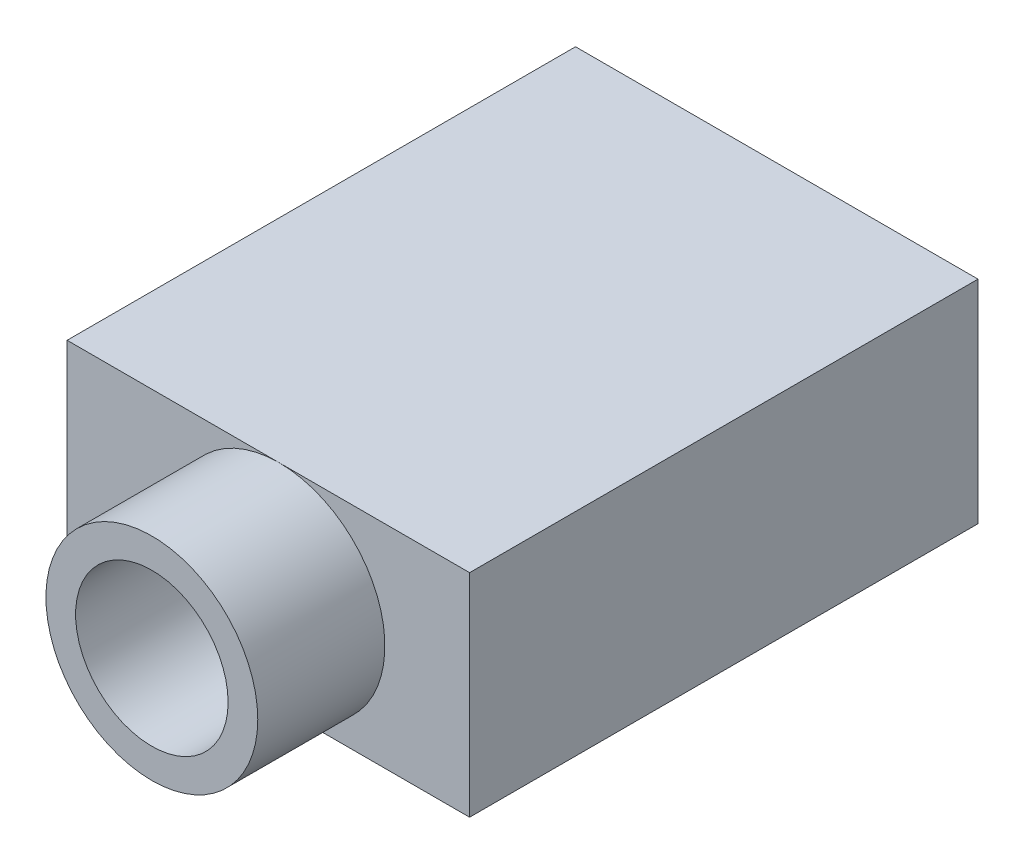
from build123d import *

# Parameters (mm, degrees)
SKETCH1_W           = 9.5
SKETCH1_H           = 12
BOSS_EXTRUDE1_DEPTH = 5
SKETCH2_R           = 2.5
SKETCH2_R_2         = 1.8
BOSS_EXTRUDE2_DEPTH = 3
SKETCH3_R           = 0.8
BOSS_EXTRUDE3_DEPTH = 1


with BuildPart() as part:
    # Sketch1 → Boss-Extrude1 (new body)
    with BuildSketch(Plane(origin=(0, 0, 0), x_dir=(1, 0, 0), z_dir=(0, 1, 0))):
        with Locations((4.75, 6)):
            Rectangle(SKETCH1_W, SKETCH1_H)
    extrude(amount=BOSS_EXTRUDE1_DEPTH)

    # Sketch2 → Boss-Extrude2 (add)
    with BuildSketch(Plane.XY):
        with Locations(Location((5, 2.5, 0), (0, 0, 270))):
            Circle(SKETCH2_R)
        with Locations((5, 2.5)):
            Circle(SKETCH2_R_2, mode=Mode.SUBTRACT)
    extrude(amount=BOSS_EXTRUDE2_DEPTH)

    # Sketch3 → Boss-Extrude3 (add)
    with BuildSketch(Plane.XZ):
        with Locations(Location((5, -3, 0), (0, 0, 270))):
            Circle(SKETCH3_R)
        with Locations(Location((5, -9, 0), (0, 0, 270))):
            Circle(SKETCH3_R)
    extrude(amount=BOSS_EXTRUDE3_DEPTH)


solid = part.part
